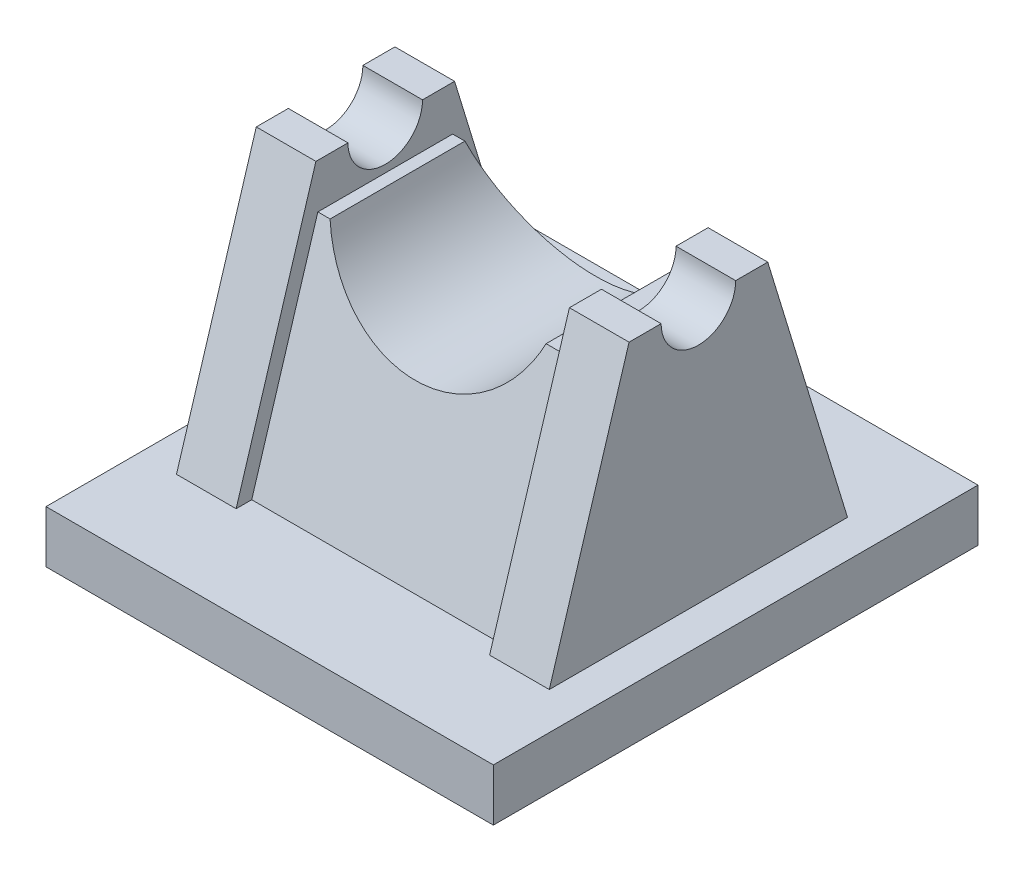
from build123d import *

# Parameters (mm, degrees)
BOSS_EXTRUDE1_DEPTH = 50
CUT_EXTRUDE1_START  = -8
CUT_EXTRUDE1_DEPTH  = 34
CUT_EXTRUDE2_DEPTH  = 34
SKETCH5_W           = 60
SKETCH5_H           = 65
BOSS_EXTRUDE3_DEPTH = 7


with BuildPart() as part:
    # Sketch2 → Boss-Extrude1 (new body)
    with BuildSketch(Plane(origin=(0, 0, 0), x_dir=(0, 0, -1), z_dir=(1, 0, 0))):
        with BuildLine():
            Line((40, 0), (0, 0))
            Line((0, 0), (10.700573851, 35))
            Line((10.700573851, 35), (15, 35))
            ThreePointArc((15, 35), (20, 30), (25, 35))
            Line((25, 35), (29.299426149, 35))
            Line((29.299426149, 35), (40, 0))
        make_face()
    extrude(amount=-BOSS_EXTRUDE1_DEPTH)

    # Sketch3 → Cut-Extrude1 (cut)
    with BuildSketch(Plane(origin=(0, 0, 0), x_dir=(0, 0, -1), z_dir=(1, 0, 0)).offset(CUT_EXTRUDE1_START)):
        Polygon((10.700573851, 35), (0, 0), (2.091383513, 0), (10.957573275, 29), (29.042426725, 29), (37.908616487, 0), (40, 0), (29.299426149, 35), (27.730888514, 35), (12.269111486, 35), align=None)
    extrude(amount=-CUT_EXTRUDE1_DEPTH, mode=Mode.SUBTRACT)

    # Sketch4 → Cut-Extrude2 (cut)
    with BuildSketch(Plane.XY):
        with BuildLine():
            Line((-11.388981029, 29), (-40.360215297, 29))
            ThreePointArc((-40.360215297, 29), (-25.874598163, 19.015151515), (-11.388981029, 29))
        make_face()
    extrude(amount=-CUT_EXTRUDE2_DEPTH, mode=Mode.SUBTRACT)

    # Sketch5 → Boss-Extrude3 (add)
    with BuildSketch(Plane.XZ):
        with Locations((-25, -20)):
            Rectangle(SKETCH5_W, SKETCH5_H)
    extrude(amount=BOSS_EXTRUDE3_DEPTH)


solid = part.part
